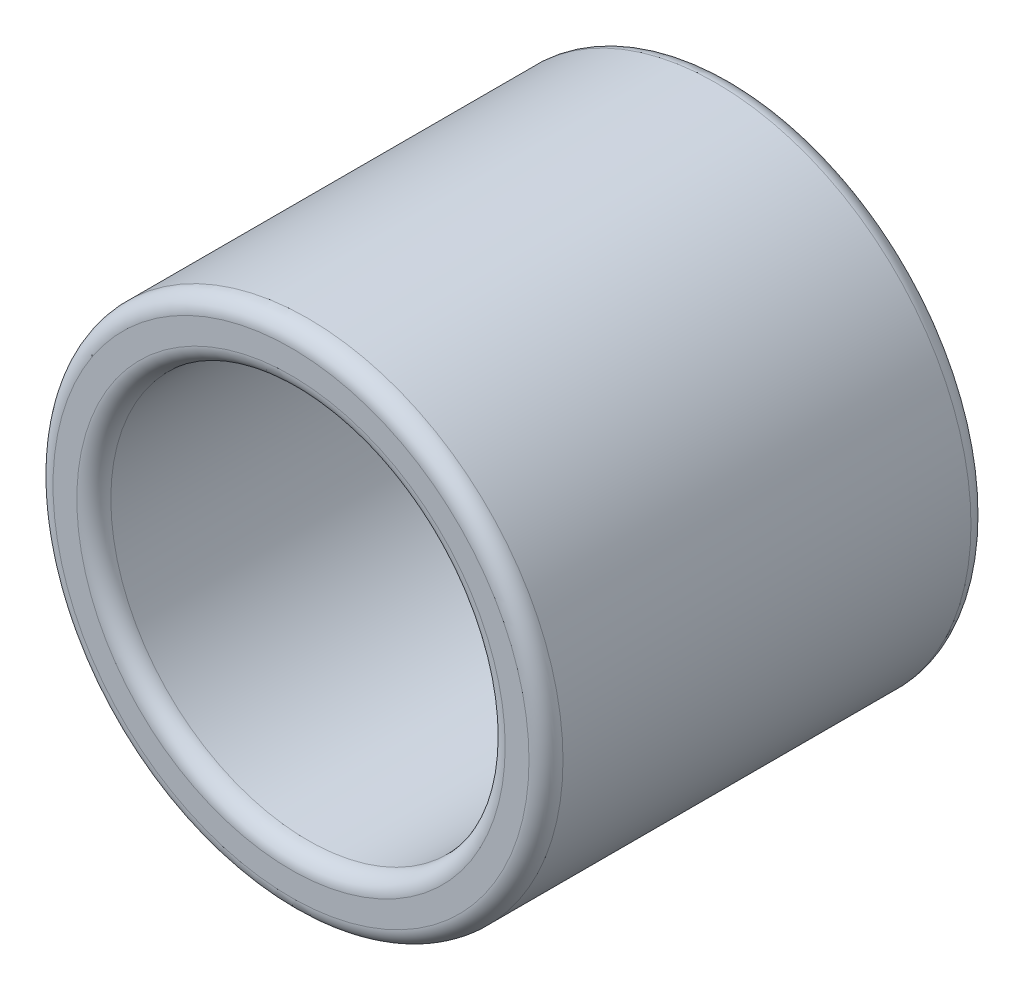
from build123d import *

# Parameters (mm, degrees)
SKETCH1_R           = 7.5
BOSS_EXTRUDE1_DEPTH = 13
SKETCH3_R           = 5.8
CUT_EXTRUDE1_DEPTH  = 10
FILLET1_R           = 0.5


with BuildPart() as part:
    # Sketch1 → Boss-Extrude1 (new body)
    with BuildSketch(Plane.XY):
        with Locations(Location((0, 0, 0), (0, 0, 180))):
            Circle(SKETCH1_R)
    extrude(amount=BOSS_EXTRUDE1_DEPTH)

    # Sketch3 → Cut-Extrude1 (cut)
    with BuildSketch(Plane.XY.offset(13)):
        Circle(SKETCH3_R)
    extrude(amount=-CUT_EXTRUDE1_DEPTH, mode=Mode.SUBTRACT)

    # Fillet1
    fillet1_edges = [part.edges().sort_by_distance(p)[0] for p in [
        (7.5, 0, 0),
        (7.5, 0, 13),
        (-5.8, 0, 3),
        (-5.8, 0, 13),
    ]]
    fillet(fillet1_edges, radius=FILLET1_R)


solid = part.part
